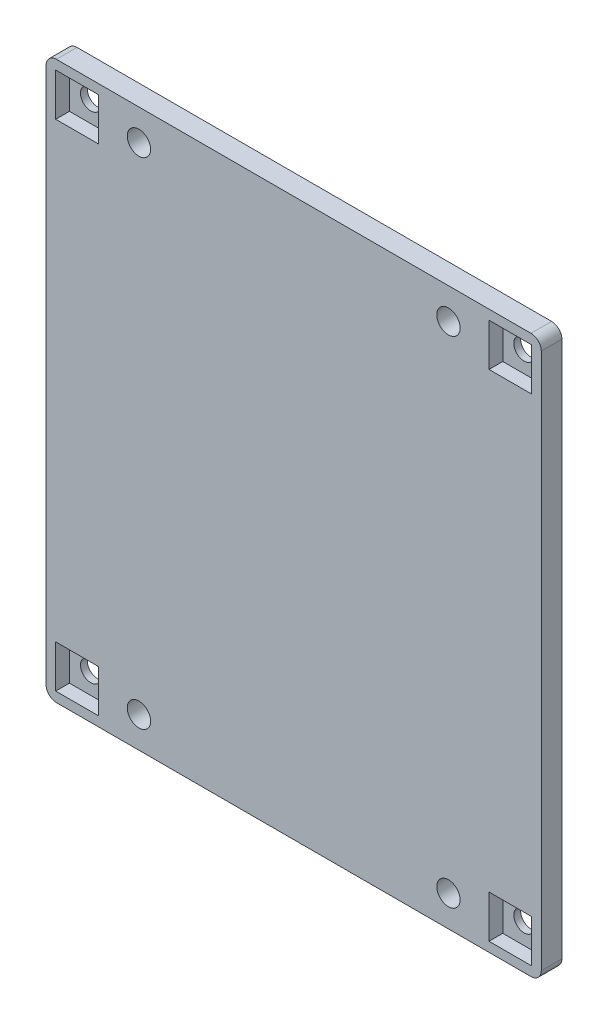
from build123d import *

# Parameters (mm, degrees)
MODEL_R                 = 1.5
MODEL_R_2               = 1.7
SALIENTE_EXTRUIR1_DEPTH = 3
CROQUIS2_W              = 6.2
CROQUIS2_H              = 6.2
CORTAR_EXTRUIR1_DEPTH   = 2


with BuildPart() as part:
    # Model → Saliente-Extruir1 (new body)
    with BuildSketch(Plane.XY):
        with BuildLine():
            Line((6.187693969, 221.409928006), (6.187693969, 299.414537864))
            ThreePointArc((6.187693969, 299.414537864), (6.627033797, 300.475198036), (7.687693969, 300.914537864))
            Line((7.687693969, 300.914537864), (76.690098203, 300.914537864))
            ThreePointArc((76.690098203, 300.914537864), (77.750758375, 300.475198036), (78.190098203, 299.414537864))
            Line((78.190098203, 299.414537864), (78.190098203, 221.409928006))
            ThreePointArc((78.190098203, 221.409928006), (77.750758375, 220.349267835), (76.690098203, 219.909928006))
            Line((76.690098203, 219.909928006), (7.687693969, 219.909928006))
            ThreePointArc((7.687693969, 219.909928006), (6.627033797, 220.349267835), (6.187693969, 221.409928006))
        make_face()
        with Locations((73.690098203, 224.409593504)):
            Circle(MODEL_R, mode=Mode.SUBTRACT)
        with Locations((10.687359467, 296.414537864)):
            Circle(MODEL_R, mode=Mode.SUBTRACT)
        with Locations((10.687359467, 224.409593504)):
            Circle(MODEL_R, mode=Mode.SUBTRACT)
        with Locations((73.690098203, 296.414537864)):
            Circle(MODEL_R, mode=Mode.SUBTRACT)
        with Locations((19.687024964, 296.414537864)):
            Circle(MODEL_R_2, mode=Mode.SUBTRACT)
        with Locations((64.690432705, 296.414537864)):
            Circle(MODEL_R_2, mode=Mode.SUBTRACT)
        with Locations((19.687024964, 224.409593504)):
            Circle(MODEL_R_2, mode=Mode.SUBTRACT)
        with Locations((64.690432705, 224.409593504)):
            Circle(MODEL_R_2, mode=Mode.SUBTRACT)
    extrude(amount=SALIENTE_EXTRUIR1_DEPTH)

    # Croquis2 → Cortar-Extruir1 (cut)
    with BuildSketch(Plane.XY.offset(3)):
        with Locations((10.687359467, 296.414537864)):
            Rectangle(CROQUIS2_W, CROQUIS2_H)
        with Locations((73.690098203, 296.414537864)):
            Rectangle(CROQUIS2_W, CROQUIS2_H)
        with Locations((73.690098203, 224.409593504)):
            Rectangle(CROQUIS2_W, CROQUIS2_H)
        with Locations((10.687359467, 224.409593504)):
            Rectangle(CROQUIS2_W, CROQUIS2_H)
    extrude(amount=-CORTAR_EXTRUIR1_DEPTH, mode=Mode.SUBTRACT)


solid = part.part
